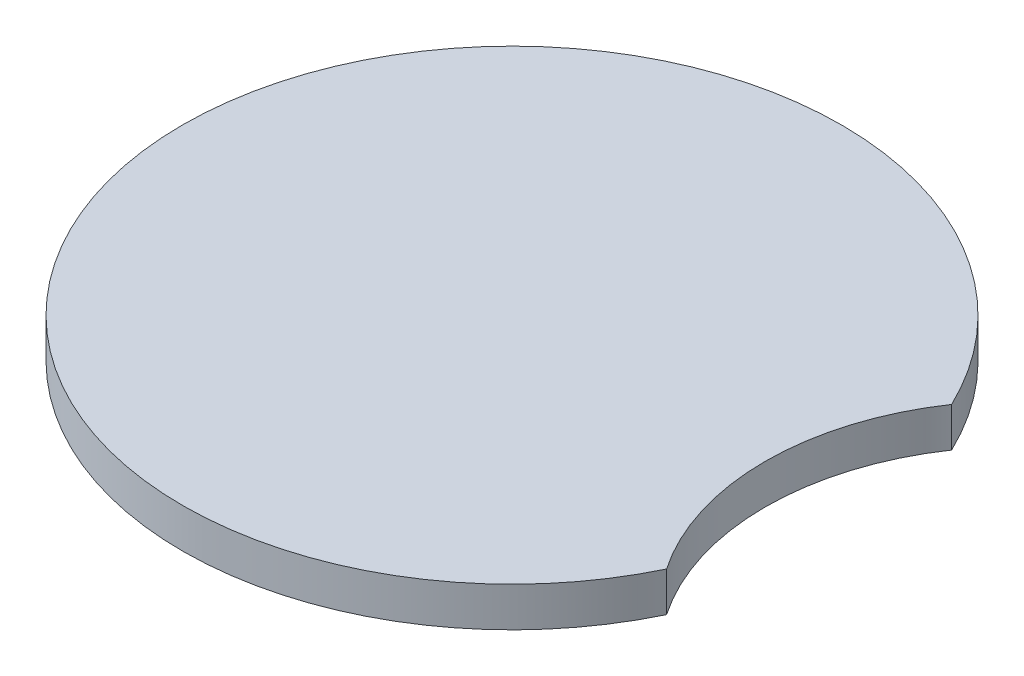
from build123d import *

# Parameters (mm, degrees)
SALIENTE_EXTRUIR1_DEPTH = 3


with BuildPart() as part:
    # Croquis1 → Saliente-Extruir1 (new body)
    with BuildSketch(Plane(origin=(0, 0, 0), x_dir=(1, 0, 0), z_dir=(0, 1, 0))):
        with BuildLine():
            ThreePointArc((22.540175286, 10.813903), (-25, 0), (22.540175286, -10.813903))
            ThreePointArc((22.540175286, -10.813903), (19.206602866, 0), (22.540175286, 10.813903))
        make_face()
    extrude(amount=SALIENTE_EXTRUIR1_DEPTH)


solid = part.part
